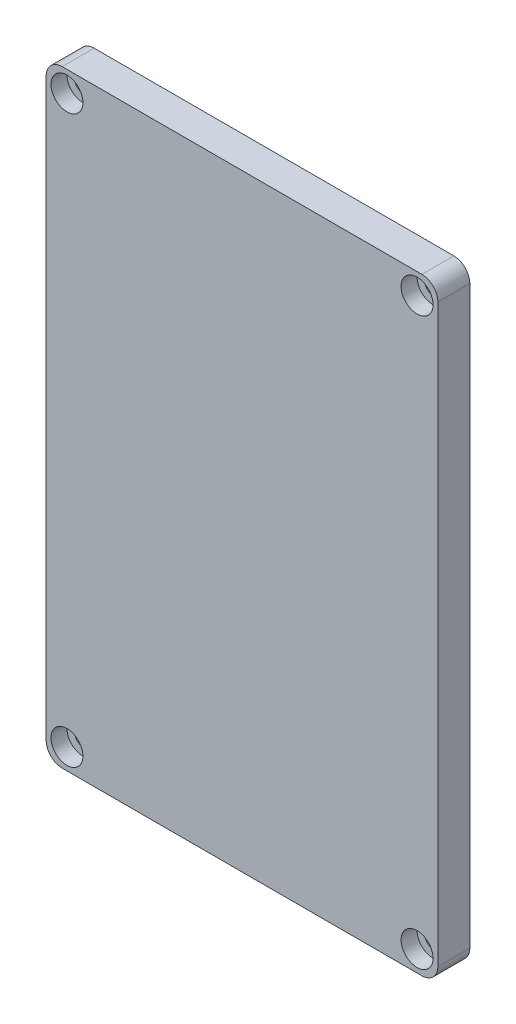
from build123d import *

# Parameters (mm, degrees)
SKETCH_1_W          = 24.5
SKETCH_1_H          = 38
EXTRUDE_1_DEPTH     = 2
SKETCH_4_R          = 2.05
CUT_EXTRUDE_1_DEPTH = 1
SKETCH_9_R          = 1
CUT_EXTRUDE_3_DEPTH = 1
CUT_EXTRUDE_4_REACH = 146.905
SKETCH_10_R         = 0.5
FILLET_1_R          = 1
SKETCH_11_W         = 5.762947655
SKETCH_11_H         = 2.6557086
EXTRUDE_2_DEPTH     = 5
SKETCH_12_W         = 8
SKETCH_12_H         = 1.496173859
EXTRUDE_3_DEPTH     = 5


with BuildPart() as part:
    # 草图1 → 凸台-拉伸1 (new body)
    with BuildSketch(Plane.XY):
        with Locations((-110.040086771, 58.72858385)):
            Rectangle(SKETCH_1_W, SKETCH_1_H)
    extrude(amount=EXTRUDE_1_DEPTH)

    # 草图4 → 切除-拉伸1 (cut)
    with BuildSketch(Plane(origin=(0, 0, 0), x_dir=(-1, 0, 0), z_dir=(0, 0, -1))):
        with Locations((118.450086771, 67.72858385)):
            Circle(SKETCH_4_R)
    extrude(amount=-CUT_EXTRUDE_1_DEPTH, mode=Mode.SUBTRACT)

    # 草图9 → 切除-拉伸3 (cut)
    with BuildSketch(Plane.XY.offset(2)):
        with Locations((-99.090086771, 76.42858385)):
            Circle(SKETCH_9_R)
        with Locations((-99.090086771, 41.02858385)):
            Circle(SKETCH_9_R)
        with Locations((-120.990086771, 41.02858385)):
            Circle(SKETCH_9_R)
        with Locations((-120.990086771, 76.42858385)):
            Circle(SKETCH_9_R)
    extrude(amount=-CUT_EXTRUDE_3_DEPTH, mode=Mode.SUBTRACT)

    # 草图10 → 切除-拉伸4 (cut, up to next)
    with BuildSketch(Plane.XY.offset(1), mode=Mode.PRIVATE) as cut_extrude_4_sk1:
        with Locations((-120.990086771, 41.02858385)):
            Circle(SKETCH_10_R)
    cut_extrude_4_tool1 = extrude(cut_extrude_4_sk1.sketch, amount=-CUT_EXTRUDE_4_REACH, mode=Mode.PRIVATE) & part.part
    # 草图10 → 切除-拉伸4 (cut, up to next)
    with BuildSketch(Plane.XY.offset(1), mode=Mode.PRIVATE) as cut_extrude_4_sk2:
        with Locations((-99.090086771, 41.02858385)):
            Circle(SKETCH_10_R)
    cut_extrude_4_tool2 = extrude(cut_extrude_4_sk2.sketch, amount=-CUT_EXTRUDE_4_REACH, mode=Mode.PRIVATE) & part.part
    # 草图10 → 切除-拉伸4 (cut, up to next)
    with BuildSketch(Plane.XY.offset(1), mode=Mode.PRIVATE) as cut_extrude_4_sk3:
        with Locations((-99.090086771, 76.42858385)):
            Circle(SKETCH_10_R)
    cut_extrude_4_tool3 = extrude(cut_extrude_4_sk3.sketch, amount=-CUT_EXTRUDE_4_REACH, mode=Mode.PRIVATE) & part.part
    # 草图10 → 切除-拉伸4 (cut, up to next)
    with BuildSketch(Plane.XY.offset(1), mode=Mode.PRIVATE) as cut_extrude_4_sk4:
        with Locations((-120.990086771, 76.42858385)):
            Circle(SKETCH_10_R)
    cut_extrude_4_tool4 = extrude(cut_extrude_4_sk4.sketch, amount=-CUT_EXTRUDE_4_REACH, mode=Mode.PRIVATE) & part.part
    add(cut_extrude_4_tool1.solids().sort_by_distance((-120.990087, 41.028584, 1))[0], mode=Mode.SUBTRACT)
    add(cut_extrude_4_tool2.solids().sort_by_distance((-99.090087, 41.028584, 1))[0], mode=Mode.SUBTRACT)
    add(cut_extrude_4_tool3.solids().sort_by_distance((-99.090087, 76.428584, 1))[0], mode=Mode.SUBTRACT)
    add(cut_extrude_4_tool4.solids().sort_by_distance((-120.990087, 76.428584, 1))[0], mode=Mode.SUBTRACT)

    # 圆角1
    fillet_1_edges = [part.edges().sort_by_distance(p)[0] for p in [
        (-97.790086771, 77.72858385, 1),
        (-97.790086771, 39.72858385, 1),
        (-122.290086771, 39.72858385, 1),
        (-122.290086771, 77.72858385, 1),
    ]]
    fillet(fillet_1_edges, radius=FILLET_1_R)

    # 草图11 → 凸台-拉伸2 (add)
    with BuildSketch(Plane(origin=(0, 0, 0), x_dir=(-1, 0, 0), z_dir=(0, 0, -1))):
        with Locations((108.208612944, 65.75072955)):
            Rectangle(SKETCH_11_W, SKETCH_11_H)
    extrude(amount=EXTRUDE_2_DEPTH)

    # 草图12 → 凸台-拉伸3 (add)
    with BuildSketch(Plane(origin=(0, 0, 0), x_dir=(-1, 0, 0), z_dir=(0, 0, -1))):
        with Locations((110.636291242, 49.77667078)):
            Rectangle(SKETCH_12_W, SKETCH_12_H)
    extrude(amount=EXTRUDE_3_DEPTH)


solid = part.part
